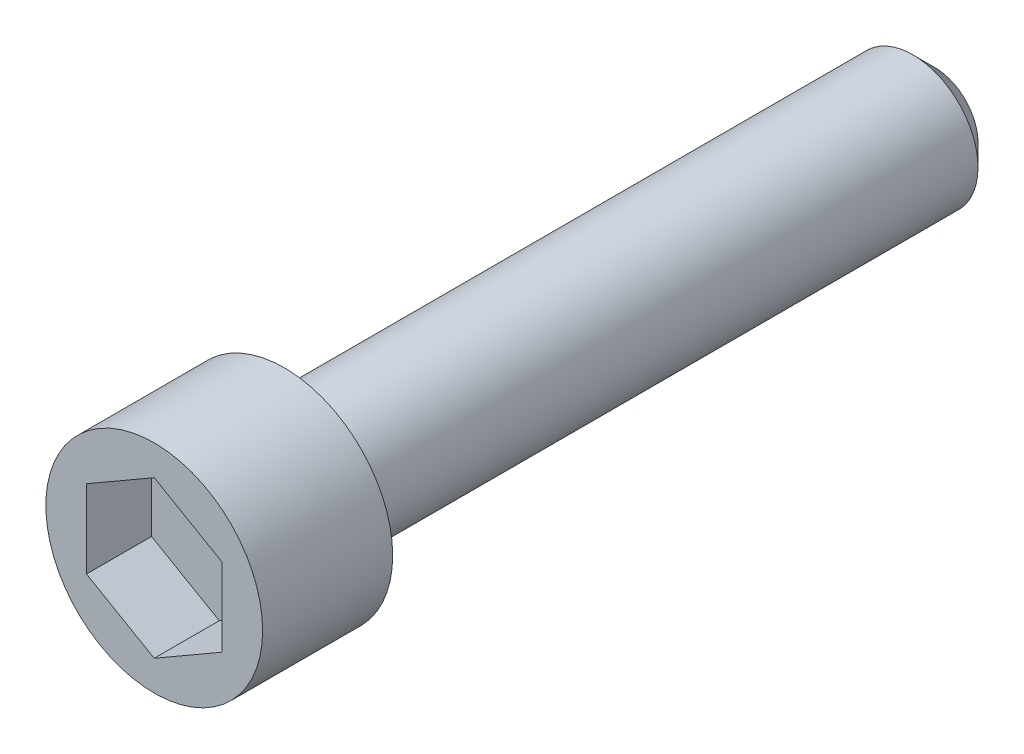
from build123d import *

# Parameters (mm, degrees)
SKETCH_1_R          = 1.5
EXTRUDE_1_DEPTH     = 15
SKETCH_2_R          = 2.5
EXTRUDE_2_DEPTH     = 3
CUT_EXTRUDE_1_DEPTH = 1.5
CHAMFER_1_SIZE      = 0.5


with BuildPart() as part:
    # 草图1 → 凸台-拉伸1 (new body)
    with BuildSketch(Plane.XY):
        Circle(SKETCH_1_R)
    extrude(amount=EXTRUDE_1_DEPTH)

    # 草图2 → 凸台-拉伸2 (add)
    with BuildSketch(Plane.XY.offset(15)):
        Circle(SKETCH_2_R)
    extrude(amount=EXTRUDE_2_DEPTH)

    # 草图3 → 切除-拉伸1 (cut)
    with BuildSketch(Plane.XY.offset(18)):
        Polygon((0, 1.803382283), (-1.56177487, 0.901691141), (-1.56177487, -0.901691141), (0, -1.803382283), (1.56177487, -0.901691141), (1.56177487, 0.901691141), align=None)
    extrude(amount=-CUT_EXTRUDE_1_DEPTH, mode=Mode.SUBTRACT)

    # 倒角1
    chamfer_1_edges = [part.edges().sort_by_distance(p)[0] for p in [
        (-1.5, 0, 0),
    ]]
    chamfer(chamfer_1_edges, length=CHAMFER_1_SIZE)


solid = part.part
